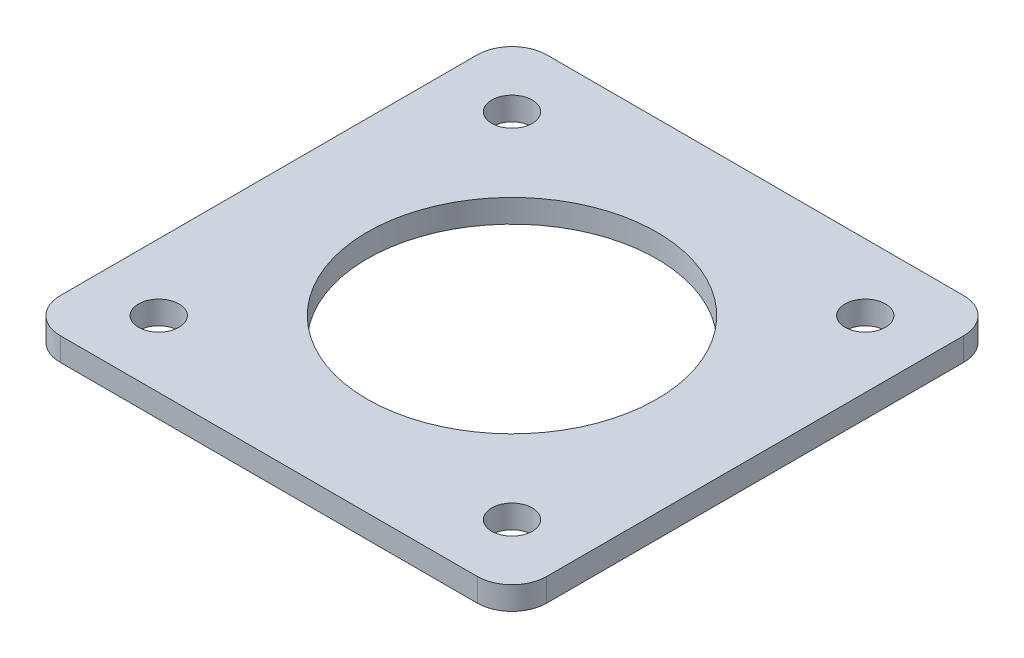
from build123d import *

# Parameters (mm, degrees)
SZKIC1_R                    = 12.5
SZKIC1_R_2                  = 1.75
DODANIE_WYCI_GNI_CIE1_DEPTH = 2


with BuildPart() as part:
    # Szkic1 → Dodanie-wyciągnięcie1 (new body)
    with BuildSketch(Plane(origin=(0, 0, 0), x_dir=(1, 0, 0), z_dir=(0, 1, 0))):
        with BuildLine():
            Line((3, 0), (39, 0))
            ThreePointArc((39, 0), (41.121320344, 0.878679656), (42, 3))
            Line((42, 3), (42, 39))
            ThreePointArc((42, 39), (41.121320344, 41.121320344), (39, 42))
            Line((39, 42), (3, 42))
            ThreePointArc((3, 42), (0.878679656, 41.121320344), (0, 39))
            Line((0, 39), (0, 3))
            ThreePointArc((0, 3), (0.878679656, 0.878679656), (3, 0))
        make_face()
        with Locations(Location((21, 21, 0), (0, 0, 270))):
            Circle(SZKIC1_R, mode=Mode.SUBTRACT)
        with Locations(Location((5.75, 36.25, 0), (0, 0, 270))):
            Circle(SZKIC1_R_2, mode=Mode.SUBTRACT)
        with Locations(Location((36.25, 36.25, 0), (0, 0, 90))):
            Circle(SZKIC1_R_2, mode=Mode.SUBTRACT)
        with Locations(Location((36.25, 5.75, 0), (0, 0, 270))):
            Circle(SZKIC1_R_2, mode=Mode.SUBTRACT)
        with Locations(Location((5.75, 5.75, 0), (0, 0, 90))):
            Circle(SZKIC1_R_2, mode=Mode.SUBTRACT)
    extrude(amount=DODANIE_WYCI_GNI_CIE1_DEPTH)


solid = part.part
